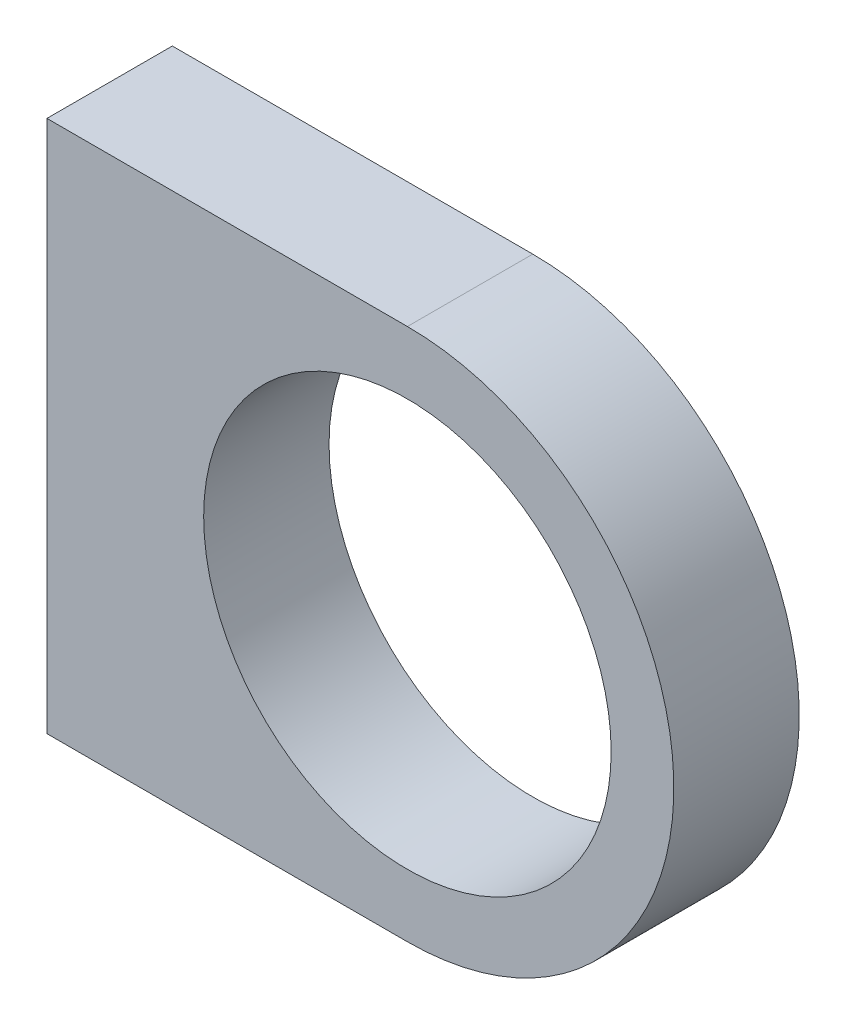
from build123d import *

# Parameters (mm, degrees)
SKETCH2_R           = 13
BOSS_EXTRUDE1_DEPTH = 8


with BuildPart() as part:
    # Sketch2 → Boss-Extrude1 (new body)
    with BuildSketch(Plane.XY):
        with BuildLine():
            Line((22.912878475, 16.112283523), (-0.087121525, 16.112283523))
            Line((-0.087121525, 16.112283523), (-0.087121525, -17.887716477))
            Line((-0.087121525, -17.887716477), (22.912878475, -17.887716477))
            ThreePointArc((22.912878475, -17.887716477), (39.912878475, -0.887716477), (22.912878475, 16.112283523))
        make_face()
        with Locations((22.912878475, -0.887716477)):
            Circle(SKETCH2_R, mode=Mode.SUBTRACT)
    extrude(amount=BOSS_EXTRUDE1_DEPTH)


solid = part.part
